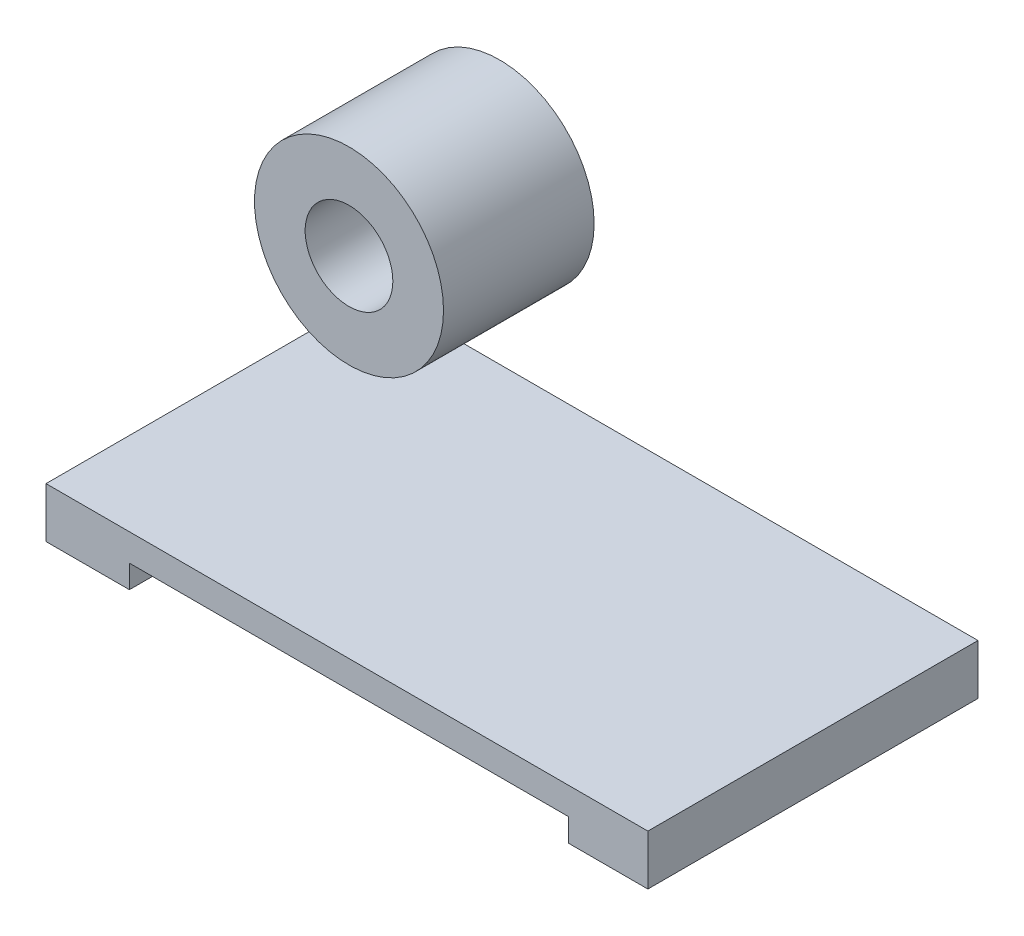
from build123d import *

# Parameters (mm, degrees)
SKETCH_1_W          = 119.884331053
SKETCH_1_H          = 65.756914518
EXTRUDE_1_DEPTH     = 10
SKETCH_2_W          = 87.478296183
SKETCH_2_H          = 12.183988045
CUT_EXTRUDE_1_DEPTH = 105
SKETCH_3_R          = 18.827887846
SKETCH_3_R_2        = 8.732446569
EXTRUDE_2_DEPTH     = 30


with BuildPart() as part:
    # 草图1 → 凸台-拉伸1 (new body)
    with BuildSketch(Plane(origin=(0, 0, 0), x_dir=(1, 0, 0), z_dir=(0, 1, 0))):
        with Locations((59.942165527, 32.878457259)):
            Rectangle(SKETCH_1_W, SKETCH_1_H)
    extrude(amount=EXTRUDE_1_DEPTH)

    # 草图2 → 切除-拉伸1 (cut)
    with BuildSketch(Plane.XY):
        with Locations((60.352861753, -1.502690248)):
            Rectangle(SKETCH_2_W, SKETCH_2_H)
    extrude(amount=-CUT_EXTRUDE_1_DEPTH, mode=Mode.SUBTRACT)


with BuildPart() as body_2:
    # 草图3 → 凸台-拉伸2 (new body)
    with BuildSketch(Plane.XY):
        with Locations((60.352861753, 79.45286153)):
            Circle(SKETCH_3_R)
        with Locations((60.352861753, 79.45286153)):
            Circle(SKETCH_3_R_2, mode=Mode.SUBTRACT)
    extrude(amount=-EXTRUDE_2_DEPTH)


solid = Compound([part.part, body_2.part])
